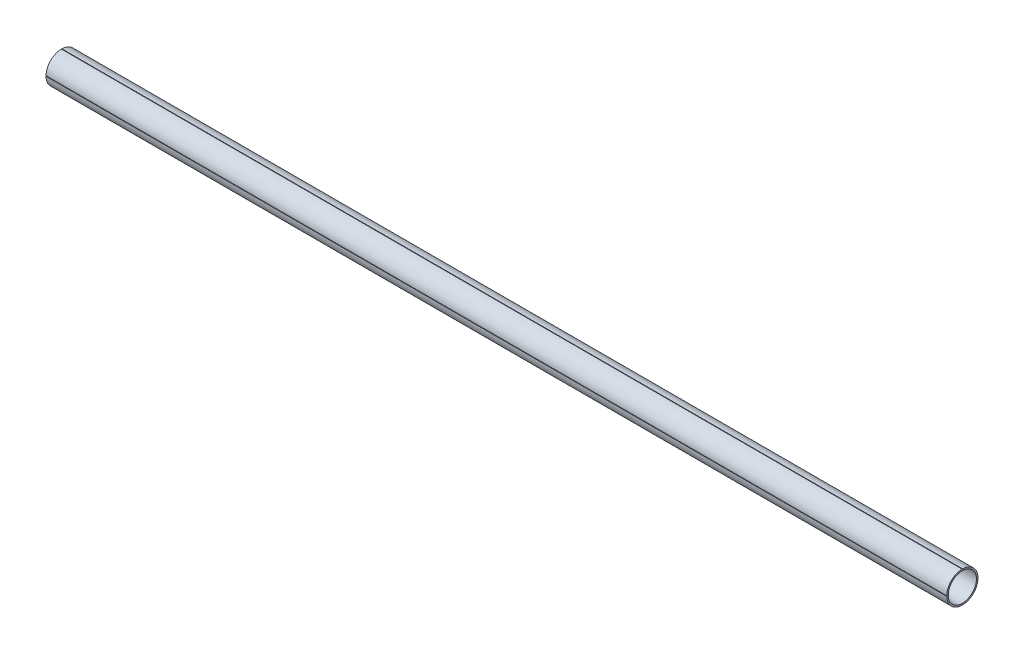
from build123d import *

# Parameters (mm, degrees)
SKETCH1_R           = 14.3
BOSS_EXTRUDE1_DEPTH = 914.4


with BuildPart() as part:
    # Sketch1 → Boss-Extrude1 (new body)
    with BuildSketch(Plane(origin=(457.2, 0, 0), x_dir=(0, 0, -1), z_dir=(1, 0, 0))):
        with BuildLine():
            Line((-0.25, -15.873031374), (0, -15.575))
            Line((0, -15.575), (0.25, -15.873031374))
            ThreePointArc((0.25, -15.873031374), (11.225320151, -11.225320151), (15.873031374, -0.25))
            Line((15.873031374, -0.25), (15.575, 0))
            Line((15.575, 0), (15.873031374, 0.25))
            ThreePointArc((15.873031374, 0.25), (11.225320151, 11.225320151), (0.25, 15.873031374))
            Line((0.25, 15.873031374), (0, 15.575))
            Line((0, 15.575), (-0.25, 15.873031374))
            ThreePointArc((-0.25, 15.873031374), (-11.225320151, 11.225320151), (-15.873031374, 0.25))
            Line((-15.873031374, 0.25), (-15.575, 0))
            Line((-15.575, 0), (-15.873031374, -0.25))
            ThreePointArc((-15.873031374, -0.25), (-11.225320151, -11.225320151), (-0.25, -15.873031374))
        make_face()
        with Locations(Location((0, 0, 0), (0, 0, 180))):
            Circle(SKETCH1_R, mode=Mode.SUBTRACT)
    extrude(amount=-BOSS_EXTRUDE1_DEPTH)


solid = part.part
